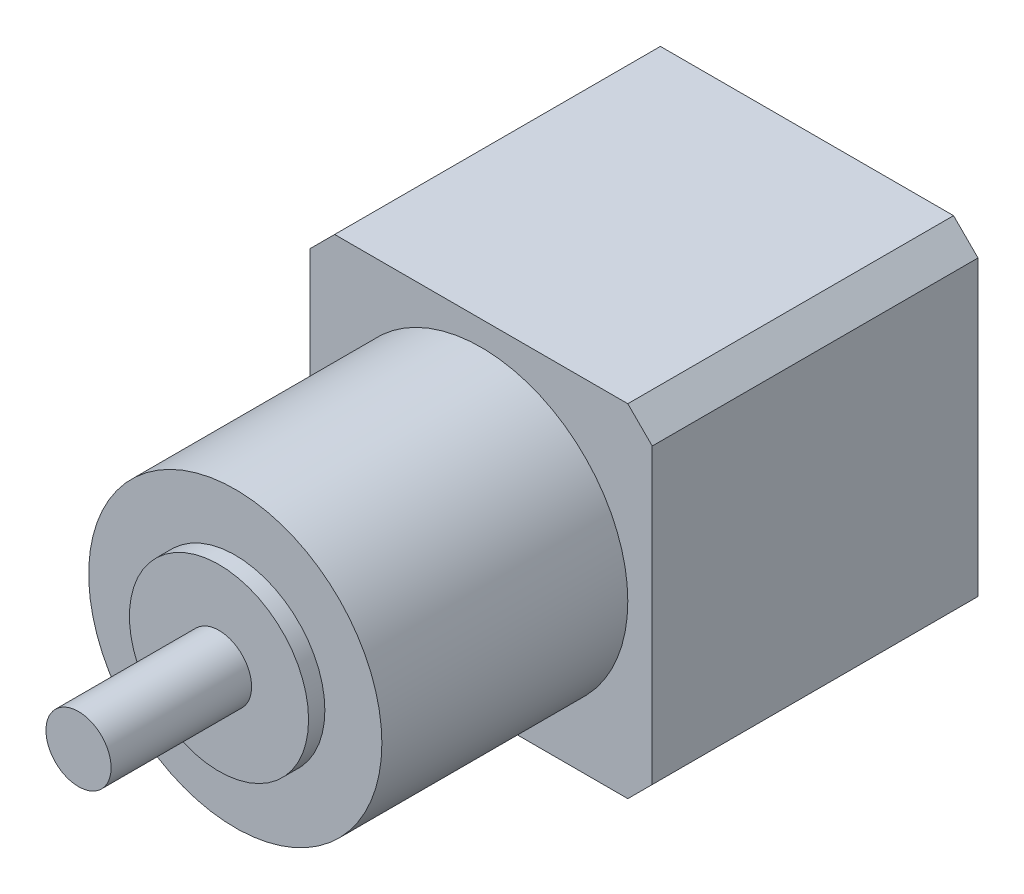
from build123d import *

# Parameters (mm, degrees)
BOSS_EXTRUDE1_DEPTH = 40
SKETCH2_R           = 18
BOSS_EXTRUDE2_DEPTH = 30.2
SKETCH3_R           = 11
BOSS_EXTRUDE3_DEPTH = 2
SKETCH4_R           = 4
BOSS_EXTRUDE4_DEPTH = 17.25


with BuildPart() as part:
    # Sketch1 → Boss-Extrude1 (new body)
    with BuildSketch(Plane.XY):
        Polygon((-21, 18), (-18, 21), (18, 21), (21, 18), (21, -18), (18, -21), (-18, -21), (-21, -18), align=None)
    extrude(amount=BOSS_EXTRUDE1_DEPTH)

    # Sketch2 → Boss-Extrude2 (add)
    with BuildSketch(Plane.XY.offset(40)):
        Circle(SKETCH2_R)
    extrude(amount=BOSS_EXTRUDE2_DEPTH)

    # Sketch3 → Boss-Extrude3 (add)
    with BuildSketch(Plane.XY.offset(70.2)):
        Circle(SKETCH3_R)
    extrude(amount=BOSS_EXTRUDE3_DEPTH)

    # Sketch4 → Boss-Extrude4 (add)
    with BuildSketch(Plane.XY.offset(72.2)):
        Circle(SKETCH4_R)
    extrude(amount=BOSS_EXTRUDE4_DEPTH)


solid = part.part
